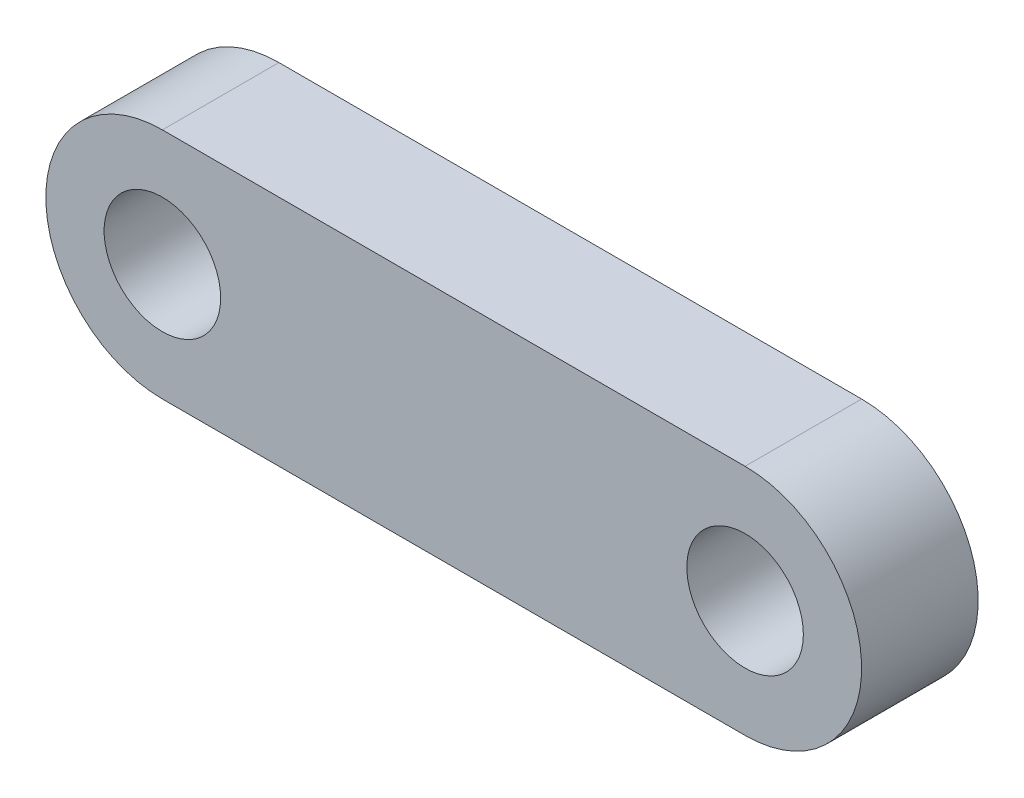
from build123d import *

# Parameters (mm, degrees)
SKETCH1_R           = 5
BOSS_EXTRUDE1_DEPTH = 5


with BuildPart() as part:
    # Sketch1 → Boss-Extrude1 (new, symmetric)
    with BuildSketch(Plane.XY):
        with BuildLine():
            Line((-25, 10), (25, 10))
            ThreePointArc((25, 10), (35, 0), (25, -10))
            Line((25, -10), (-25, -10))
            ThreePointArc((-25, -10), (-35, 0), (-25, 10))
        make_face()
        with Locations((-25, 0)):
            Circle(SKETCH1_R, mode=Mode.SUBTRACT)
        with Locations((25, 0)):
            Circle(SKETCH1_R, mode=Mode.SUBTRACT)
    extrude(amount=BOSS_EXTRUDE1_DEPTH, both=True)


solid = part.part
